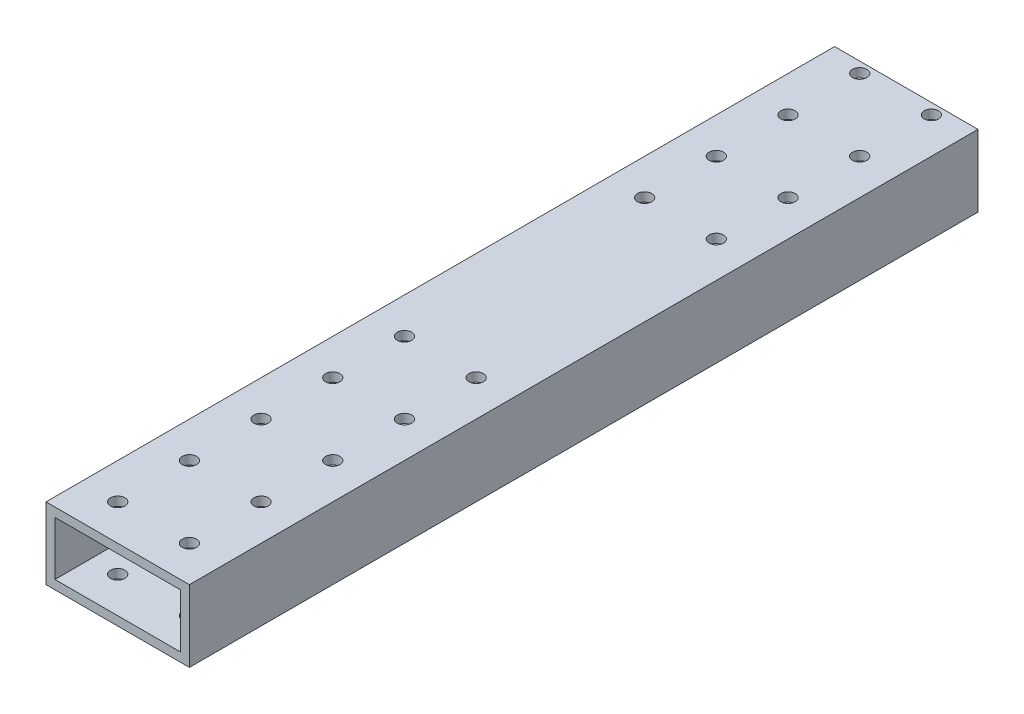
from build123d import *

# Parameters (mm, degrees)
SKETCH1_W           = 50.8
SKETCH1_H           = 25.4
SKETCH1_W_2         = 44.45
SKETCH1_H_2         = 19.05
BOSS_EXTRUDE1_DEPTH = 279.4
CUT_EXTRUDE1_REACH  = 283.7
SKETCH2_R           = 2.54


with BuildPart() as part:
    # Sketch1 → Boss-Extrude1 (new body)
    with BuildSketch(Plane.XY):
        Rectangle(SKETCH1_W, SKETCH1_H)
        Rectangle(SKETCH1_W_2, SKETCH1_H_2, mode=Mode.SUBTRACT)
    extrude(amount=BOSS_EXTRUDE1_DEPTH)

    # Cut-Extrude1: up to this face of the body (flat: up to its plane)
    cut_extrude1_end = Plane(part.part.faces().sort_by_distance((0, -12.7, 139.7))[0])
    # Sketch2 → Cut-Extrude1 (cut, up to the picked face)
    with BuildSketch(Plane(origin=(0, 12.7, 0), x_dir=(1, 0, 0), z_dir=(0, 1, 0)), mode=Mode.PRIVATE) as cut_extrude1_sk1:
        with Locations(Location((-12.7, -3.81, 0), (0, 0, 270))):
            Circle(SKETCH2_R)
    cut_extrude1_tool1 = split(extrude(cut_extrude1_sk1.sketch, amount=-CUT_EXTRUDE1_REACH, mode=Mode.PRIVATE), bisect_by=cut_extrude1_end, keep=Keep.BOTH, mode=Mode.PRIVATE)
    # Sketch2 → Cut-Extrude1 (cut, up to the picked face)
    with BuildSketch(Plane(origin=(0, 12.7, 0), x_dir=(1, 0, 0), z_dir=(0, 1, 0)), mode=Mode.PRIVATE) as cut_extrude1_sk2:
        with Locations(Location((-12.7, -266.7, 0), (0, 0, 270))):
            Circle(SKETCH2_R)
    cut_extrude1_tool2 = split(extrude(cut_extrude1_sk2.sketch, amount=-CUT_EXTRUDE1_REACH, mode=Mode.PRIVATE), bisect_by=cut_extrude1_end, keep=Keep.BOTH, mode=Mode.PRIVATE)
    # Sketch2 → Cut-Extrude1 (cut, up to the picked face)
    with BuildSketch(Plane(origin=(0, 12.7, 0), x_dir=(1, 0, 0), z_dir=(0, 1, 0)), mode=Mode.PRIVATE) as cut_extrude1_sk3:
        with Locations(Location((12.7, -266.7, 0), (0, 0, 270))):
            Circle(SKETCH2_R)
    cut_extrude1_tool3 = split(extrude(cut_extrude1_sk3.sketch, amount=-CUT_EXTRUDE1_REACH, mode=Mode.PRIVATE), bisect_by=cut_extrude1_end, keep=Keep.BOTH, mode=Mode.PRIVATE)
    # Sketch2 → Cut-Extrude1 (cut, up to the picked face)
    with BuildSketch(Plane(origin=(0, 12.7, 0), x_dir=(1, 0, 0), z_dir=(0, 1, 0)), mode=Mode.PRIVATE) as cut_extrude1_sk4:
        with Locations(Location((12.7, -241.3, 0), (0, 0, 270))):
            Circle(SKETCH2_R)
    cut_extrude1_tool4 = split(extrude(cut_extrude1_sk4.sketch, amount=-CUT_EXTRUDE1_REACH, mode=Mode.PRIVATE), bisect_by=cut_extrude1_end, keep=Keep.BOTH, mode=Mode.PRIVATE)
    # Sketch2 → Cut-Extrude1 (cut, up to the picked face)
    with BuildSketch(Plane(origin=(0, 12.7, 0), x_dir=(1, 0, 0), z_dir=(0, 1, 0)), mode=Mode.PRIVATE) as cut_extrude1_sk5:
        with Locations(Location((12.7, -215.9, 0), (0, 0, 270))):
            Circle(SKETCH2_R)
    cut_extrude1_tool5 = split(extrude(cut_extrude1_sk5.sketch, amount=-CUT_EXTRUDE1_REACH, mode=Mode.PRIVATE), bisect_by=cut_extrude1_end, keep=Keep.BOTH, mode=Mode.PRIVATE)
    # Sketch2 → Cut-Extrude1 (cut, up to the picked face)
    with BuildSketch(Plane(origin=(0, 12.7, 0), x_dir=(1, 0, 0), z_dir=(0, 1, 0)), mode=Mode.PRIVATE) as cut_extrude1_sk6:
        with Locations(Location((12.7, -190.5, 0), (0, 0, 270))):
            Circle(SKETCH2_R)
    cut_extrude1_tool6 = split(extrude(cut_extrude1_sk6.sketch, amount=-CUT_EXTRUDE1_REACH, mode=Mode.PRIVATE), bisect_by=cut_extrude1_end, keep=Keep.BOTH, mode=Mode.PRIVATE)
    # Sketch2 → Cut-Extrude1 (cut, up to the picked face)
    with BuildSketch(Plane(origin=(0, 12.7, 0), x_dir=(1, 0, 0), z_dir=(0, 1, 0)), mode=Mode.PRIVATE) as cut_extrude1_sk7:
        with Locations(Location((12.7, -165.1, 0), (0, 0, 270))):
            Circle(SKETCH2_R)
    cut_extrude1_tool7 = split(extrude(cut_extrude1_sk7.sketch, amount=-CUT_EXTRUDE1_REACH, mode=Mode.PRIVATE), bisect_by=cut_extrude1_end, keep=Keep.BOTH, mode=Mode.PRIVATE)
    # Sketch2 → Cut-Extrude1 (cut, up to the picked face)
    with BuildSketch(Plane(origin=(0, 12.7, 0), x_dir=(1, 0, 0), z_dir=(0, 1, 0)), mode=Mode.PRIVATE) as cut_extrude1_sk8:
        with Locations(Location((-12.7, -241.3, 0), (0, 0, 270))):
            Circle(SKETCH2_R)
    cut_extrude1_tool8 = split(extrude(cut_extrude1_sk8.sketch, amount=-CUT_EXTRUDE1_REACH, mode=Mode.PRIVATE), bisect_by=cut_extrude1_end, keep=Keep.BOTH, mode=Mode.PRIVATE)
    # Sketch2 → Cut-Extrude1 (cut, up to the picked face)
    with BuildSketch(Plane(origin=(0, 12.7, 0), x_dir=(1, 0, 0), z_dir=(0, 1, 0)), mode=Mode.PRIVATE) as cut_extrude1_sk9:
        with Locations(Location((-12.7, -215.9, 0), (0, 0, 270))):
            Circle(SKETCH2_R)
    cut_extrude1_tool9 = split(extrude(cut_extrude1_sk9.sketch, amount=-CUT_EXTRUDE1_REACH, mode=Mode.PRIVATE), bisect_by=cut_extrude1_end, keep=Keep.BOTH, mode=Mode.PRIVATE)
    # Sketch2 → Cut-Extrude1 (cut, up to the picked face)
    with BuildSketch(Plane(origin=(0, 12.7, 0), x_dir=(1, 0, 0), z_dir=(0, 1, 0)), mode=Mode.PRIVATE) as cut_extrude1_sk10:
        with Locations(Location((-12.7, -190.5, 0), (0, 0, 270))):
            Circle(SKETCH2_R)
    cut_extrude1_tool10 = split(extrude(cut_extrude1_sk10.sketch, amount=-CUT_EXTRUDE1_REACH, mode=Mode.PRIVATE), bisect_by=cut_extrude1_end, keep=Keep.BOTH, mode=Mode.PRIVATE)
    # Sketch2 → Cut-Extrude1 (cut, up to the picked face)
    with BuildSketch(Plane(origin=(0, 12.7, 0), x_dir=(1, 0, 0), z_dir=(0, 1, 0)), mode=Mode.PRIVATE) as cut_extrude1_sk11:
        with Locations(Location((-12.7, -165.1, 0), (0, 0, 270))):
            Circle(SKETCH2_R)
    cut_extrude1_tool11 = split(extrude(cut_extrude1_sk11.sketch, amount=-CUT_EXTRUDE1_REACH, mode=Mode.PRIVATE), bisect_by=cut_extrude1_end, keep=Keep.BOTH, mode=Mode.PRIVATE)
    # Sketch2 → Cut-Extrude1 (cut, up to the picked face)
    with BuildSketch(Plane(origin=(0, 12.7, 0), x_dir=(1, 0, 0), z_dir=(0, 1, 0)), mode=Mode.PRIVATE) as cut_extrude1_sk12:
        with Locations(Location((12.7, -3.81, 0), (0, 0, 270))):
            Circle(SKETCH2_R)
    cut_extrude1_tool12 = split(extrude(cut_extrude1_sk12.sketch, amount=-CUT_EXTRUDE1_REACH, mode=Mode.PRIVATE), bisect_by=cut_extrude1_end, keep=Keep.BOTH, mode=Mode.PRIVATE)
    # Sketch2 → Cut-Extrude1 (cut, up to the picked face)
    with BuildSketch(Plane(origin=(0, 12.7, 0), x_dir=(1, 0, 0), z_dir=(0, 1, 0)), mode=Mode.PRIVATE) as cut_extrude1_sk13:
        with Locations(Location((12.7, -29.21, 0), (0, 0, 270))):
            Circle(SKETCH2_R)
    cut_extrude1_tool13 = split(extrude(cut_extrude1_sk13.sketch, amount=-CUT_EXTRUDE1_REACH, mode=Mode.PRIVATE), bisect_by=cut_extrude1_end, keep=Keep.BOTH, mode=Mode.PRIVATE)
    # Sketch2 → Cut-Extrude1 (cut, up to the picked face)
    with BuildSketch(Plane(origin=(0, 12.7, 0), x_dir=(1, 0, 0), z_dir=(0, 1, 0)), mode=Mode.PRIVATE) as cut_extrude1_sk14:
        with Locations(Location((12.7, -54.61, 0), (0, 0, 270))):
            Circle(SKETCH2_R)
    cut_extrude1_tool14 = split(extrude(cut_extrude1_sk14.sketch, amount=-CUT_EXTRUDE1_REACH, mode=Mode.PRIVATE), bisect_by=cut_extrude1_end, keep=Keep.BOTH, mode=Mode.PRIVATE)
    # Sketch2 → Cut-Extrude1 (cut, up to the picked face)
    with BuildSketch(Plane(origin=(0, 12.7, 0), x_dir=(1, 0, 0), z_dir=(0, 1, 0)), mode=Mode.PRIVATE) as cut_extrude1_sk15:
        with Locations(Location((-12.7, -29.21, 0), (0, 0, 270))):
            Circle(SKETCH2_R)
    cut_extrude1_tool15 = split(extrude(cut_extrude1_sk15.sketch, amount=-CUT_EXTRUDE1_REACH, mode=Mode.PRIVATE), bisect_by=cut_extrude1_end, keep=Keep.BOTH, mode=Mode.PRIVATE)
    # Sketch2 → Cut-Extrude1 (cut, up to the picked face)
    with BuildSketch(Plane(origin=(0, 12.7, 0), x_dir=(1, 0, 0), z_dir=(0, 1, 0)), mode=Mode.PRIVATE) as cut_extrude1_sk16:
        with Locations(Location((-12.7, -54.61, 0), (0, 0, 270))):
            Circle(SKETCH2_R)
    cut_extrude1_tool16 = split(extrude(cut_extrude1_sk16.sketch, amount=-CUT_EXTRUDE1_REACH, mode=Mode.PRIVATE), bisect_by=cut_extrude1_end, keep=Keep.BOTH, mode=Mode.PRIVATE)
    # Sketch2 → Cut-Extrude1 (cut, up to the picked face)
    with BuildSketch(Plane(origin=(0, 12.7, 0), x_dir=(1, 0, 0), z_dir=(0, 1, 0)), mode=Mode.PRIVATE) as cut_extrude1_sk17:
        with Locations(Location((-12.7, -80.01, 0), (0, 0, 270))):
            Circle(SKETCH2_R)
    cut_extrude1_tool17 = split(extrude(cut_extrude1_sk17.sketch, amount=-CUT_EXTRUDE1_REACH, mode=Mode.PRIVATE), bisect_by=cut_extrude1_end, keep=Keep.BOTH, mode=Mode.PRIVATE)
    # Sketch2 → Cut-Extrude1 (cut, up to the picked face)
    with BuildSketch(Plane(origin=(0, 12.7, 0), x_dir=(1, 0, 0), z_dir=(0, 1, 0)), mode=Mode.PRIVATE) as cut_extrude1_sk18:
        with Locations(Location((12.7, -80.01, 0), (0, 0, 270))):
            Circle(SKETCH2_R)
    cut_extrude1_tool18 = split(extrude(cut_extrude1_sk18.sketch, amount=-CUT_EXTRUDE1_REACH, mode=Mode.PRIVATE), bisect_by=cut_extrude1_end, keep=Keep.BOTH, mode=Mode.PRIVATE)
    add(cut_extrude1_tool1.solids().sort_by(Axis((-12.7, 12.7, 3.81), (0, -1, 0)))[0], mode=Mode.SUBTRACT)
    add(cut_extrude1_tool2.solids().sort_by(Axis((-12.7, 12.7, 266.7), (0, -1, 0)))[0], mode=Mode.SUBTRACT)
    add(cut_extrude1_tool3.solids().sort_by(Axis((12.7, 12.7, 266.7), (0, -1, 0)))[0], mode=Mode.SUBTRACT)
    add(cut_extrude1_tool4.solids().sort_by(Axis((12.7, 12.7, 241.3), (0, -1, 0)))[0], mode=Mode.SUBTRACT)
    add(cut_extrude1_tool5.solids().sort_by(Axis((12.7, 12.7, 215.9), (0, -1, 0)))[0], mode=Mode.SUBTRACT)
    add(cut_extrude1_tool6.solids().sort_by(Axis((12.7, 12.7, 190.5), (0, -1, 0)))[0], mode=Mode.SUBTRACT)
    add(cut_extrude1_tool7.solids().sort_by(Axis((12.7, 12.7, 165.1), (0, -1, 0)))[0], mode=Mode.SUBTRACT)
    add(cut_extrude1_tool8.solids().sort_by(Axis((-12.7, 12.7, 241.3), (0, -1, 0)))[0], mode=Mode.SUBTRACT)
    add(cut_extrude1_tool9.solids().sort_by(Axis((-12.7, 12.7, 215.9), (0, -1, 0)))[0], mode=Mode.SUBTRACT)
    add(cut_extrude1_tool10.solids().sort_by(Axis((-12.7, 12.7, 190.5), (0, -1, 0)))[0], mode=Mode.SUBTRACT)
    add(cut_extrude1_tool11.solids().sort_by(Axis((-12.7, 12.7, 165.1), (0, -1, 0)))[0], mode=Mode.SUBTRACT)
    add(cut_extrude1_tool12.solids().sort_by(Axis((12.7, 12.7, 3.81), (0, -1, 0)))[0], mode=Mode.SUBTRACT)
    add(cut_extrude1_tool13.solids().sort_by(Axis((12.7, 12.7, 29.21), (0, -1, 0)))[0], mode=Mode.SUBTRACT)
    add(cut_extrude1_tool14.solids().sort_by(Axis((12.7, 12.7, 54.61), (0, -1, 0)))[0], mode=Mode.SUBTRACT)
    add(cut_extrude1_tool15.solids().sort_by(Axis((-12.7, 12.7, 29.21), (0, -1, 0)))[0], mode=Mode.SUBTRACT)
    add(cut_extrude1_tool16.solids().sort_by(Axis((-12.7, 12.7, 54.61), (0, -1, 0)))[0], mode=Mode.SUBTRACT)
    add(cut_extrude1_tool17.solids().sort_by(Axis((-12.7, 12.7, 80.01), (0, -1, 0)))[0], mode=Mode.SUBTRACT)
    add(cut_extrude1_tool18.solids().sort_by(Axis((12.7, 12.7, 80.01), (0, -1, 0)))[0], mode=Mode.SUBTRACT)


solid = part.part
